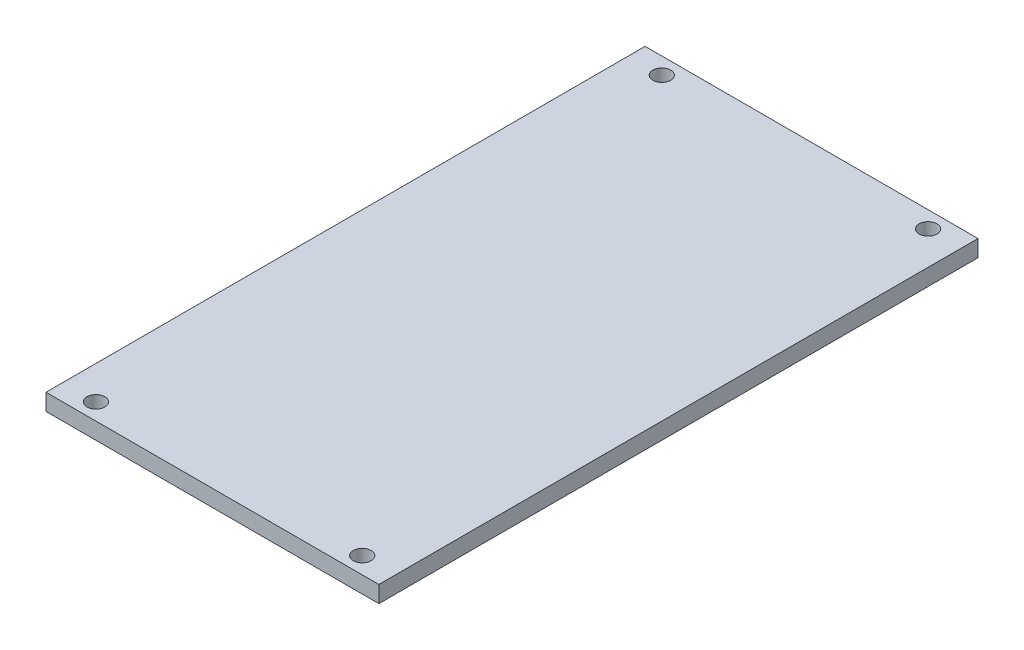
from build123d import *

# Parameters (mm, degrees)
SKETCH1_W           = 63.5
SKETCH1_H           = 114.3
BOSS_EXTRUDE1_DEPTH = 3.175
SKETCH2_R           = 1.7
CUT_EXTRUDE1_DEPTH  = 66.454301807


with BuildPart() as part:
    # Sketch1 → Boss-Extrude1 (new body)
    with BuildSketch(Plane(origin=(0, 0, 0), x_dir=(1, 0, 0), z_dir=(0, 1, 0))):
        Rectangle(SKETCH1_W, SKETCH1_H)
    extrude(amount=BOSS_EXTRUDE1_DEPTH)

    # Sketch2 → Cut-Extrude1 (cut, through all)
    with BuildSketch(Plane(origin=(0, 3.175, 0), x_dir=(1, 0, 0), z_dir=(0, 1, 0))):
        with Locations(Location((-25.4, 53.975, 0), (0, 0, 270))):
            Circle(SKETCH2_R)
        with Locations(Location((25.4, 53.975, 0), (0, 0, 270))):
            Circle(SKETCH2_R)
    cut_extrude1 = extrude(amount=-CUT_EXTRUDE1_DEPTH, mode=Mode.SUBTRACT)

    # Mirror1: Cut-Extrude1 across plane
    add(cut_extrude1.mirror(Plane.XY), mode=Mode.SUBTRACT)


solid = part.part
